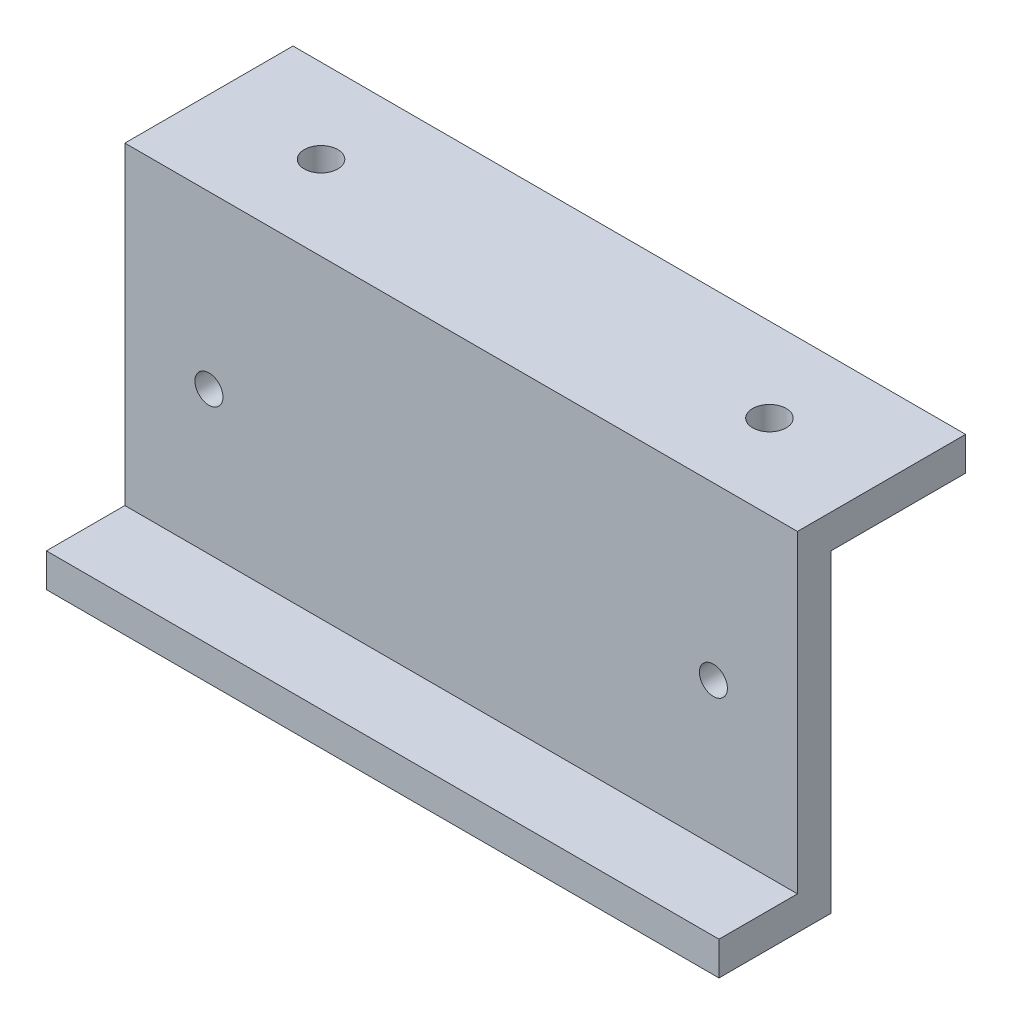
from build123d import *

# Parameters (mm, degrees)
SKETCH1_W           = 60
SKETCH1_H           = 25
SKETCH1_R           = 1.25
BOSS_EXTRUDE1_DEPTH = 3
SKETCH2_W           = 60
SKETCH2_H           = 10
BOSS_EXTRUDE2_DEPTH = 3
SKETCH3_W           = 60
SKETCH3_H           = 15
BOSS_EXTRUDE3_DEPTH = 3
SKETCH4_R           = 1.5
CUT_EXTRUDE1_DEPTH  = 3


with BuildPart() as part:
    # Sketch1 → Boss-Extrude1 (new body)
    with BuildSketch(Plane.XY):
        with Locations((30, 12.5)):
            Rectangle(SKETCH1_W, SKETCH1_H)
        with Locations((7.5, 12.75)):
            Circle(SKETCH1_R, mode=Mode.SUBTRACT)
        with Locations((52.5, 12.75)):
            Circle(SKETCH1_R, mode=Mode.SUBTRACT)
    extrude(amount=BOSS_EXTRUDE1_DEPTH)

    # Sketch2 → Boss-Extrude2 (add)
    with BuildSketch(Plane.XZ):
        with Locations((30, 5)):
            Rectangle(SKETCH2_W, SKETCH2_H)
    extrude(amount=BOSS_EXTRUDE2_DEPTH)

    # Sketch3 → Boss-Extrude3 (add)
    with BuildSketch(Plane(origin=(0, 25, 0), x_dir=(1, 0, 0), z_dir=(0, 1, 0))):
        with Locations((30, 4.5)):
            Rectangle(SKETCH3_W, SKETCH3_H)
    extrude(amount=BOSS_EXTRUDE3_DEPTH)

    # Sketch4 → Cut-Extrude1 (cut)
    with BuildSketch(Plane(origin=(0, 28, 0), x_dir=(1, 0, 0), z_dir=(0, 1, 0))):
        with Locations(Location((10, 4.5, 0), (0, 0, 270))):
            Circle(SKETCH4_R)
        with Locations(Location((50, 4.5, 0), (0, 0, 270))):
            Circle(SKETCH4_R)
    extrude(amount=-CUT_EXTRUDE1_DEPTH, mode=Mode.SUBTRACT)


solid = part.part
